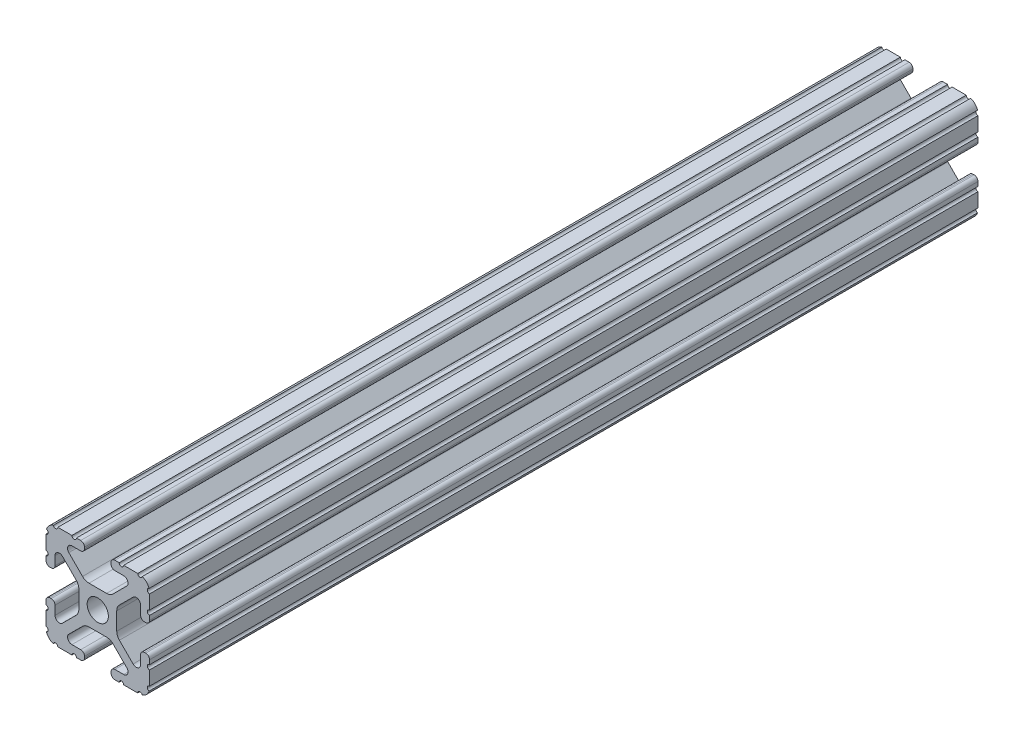
from build123d import *

# Parameters (mm, degrees)
BOSS_EXTRUDE1_DEPTH     = 152.4
CUT_EXTRUDE1_DEPTH      = 154.454683865
CUT_EXTRUDE1_DEPTH_BACK = 154.454683865
SKETCH5_R               = 0.55245
SKETCH6_W               = 50.8
SKETCH6_H               = 25.4
CUT_EXTRUDE2_DEPTH      = 156.02325632


with BuildPart() as part:
    # Sketch4 → Boss-Extrude1 (new, symmetric)
    with BuildSketch(Plane.XY):
        with BuildLine():
            Line((4.190365, -12.7), (10.11729625, -12.7))
            ThreePointArc((10.11729625, -12.7), (11.943543585, -11.943543585), (12.7, -10.11729625))
            Line((12.7, -10.11729625), (12.7, -4.190365))
            ThreePointArc((12.7, -4.190365), (12.42492494, -3.52627506), (11.760835, -3.2512))
            Line((11.760835, -3.2512), (11.429365, -3.2512))
            ThreePointArc((11.429365, -3.2512), (10.76527506, -3.52627506), (10.4902, -4.190365))
            Line((10.4902, -4.190365), (10.4902, -6.348478019))
            ThreePointArc((10.4902, -6.348478019), (9.830707141, -7.335478831), (8.666460301, -7.103895736))
            Line((8.666460301, -7.103895736), (5.299899128, -3.737334563))
            ThreePointArc((5.299899128, -3.737334563), (4.817571085, -3.015479634), (4.6482, -2.16399369))
            Line((4.6482, -2.16399369), (4.6482, 0))
            Line((4.6482, 0), (2.6035, 0))
            ThreePointArc((2.6035, 0), (1.840952505, -1.840952505), (0, -2.6035))
            Line((0, -2.6035), (0, -4.6482))
            Line((0, -4.6482), (2.16399369, -4.6482))
            ThreePointArc((2.16399369, -4.6482), (3.015479634, -4.817571085), (3.737334563, -5.299899128))
            Line((3.737334563, -5.299899128), (7.103895736, -8.666460301))
            ThreePointArc((7.103895736, -8.666460301), (7.335478831, -9.830707141), (6.348478019, -10.4902))
            Line((6.348478019, -10.4902), (4.190365, -10.4902))
            ThreePointArc((4.190365, -10.4902), (3.52627506, -10.76527506), (3.2512, -11.429365))
            Line((3.2512, -11.429365), (3.2512, -11.760835))
            ThreePointArc((3.2512, -11.760835), (3.52627506, -12.42492494), (4.190365, -12.7))
        make_face()
    extrude(amount=BOSS_EXTRUDE1_DEPTH, both=True)

    # Sketch5 → Cut-Extrude1 (cut, two sides: drawn at the far end of the back side and taken through both)
    with BuildSketch(Plane.XY.offset(-CUT_EXTRUDE1_DEPTH_BACK)):
        with Locations((10.356153152, -12.7)):
            Circle(SKETCH5_R)
        with Locations((5.796028019, -12.7)):
            Circle(SKETCH5_R)
        with Locations((12.7, -10.356153152)):
            Circle(SKETCH5_R)
        with Locations((12.7, -5.796028019)):
            Circle(SKETCH5_R)
    extrude(amount=CUT_EXTRUDE1_DEPTH + CUT_EXTRUDE1_DEPTH_BACK, mode=Mode.SUBTRACT)

    # Mirror1: part across plane


with BuildPart() as part_1:
    add(part.part)
    add(part.part.mirror(Plane(origin=(0, 0, 0), x_dir=(0, 0, 1), z_dir=(1, 0, 0))))

    # Mirror2: part across plane


with BuildPart() as part_2:
    add(part_1.part)
    add(part_1.part.mirror(Plane.ZX))

    # Sketch6 → Cut-Extrude2 (cut, through all)
    with BuildSketch(Plane(origin=(12.7, 0, 0), x_dir=(0, 0, -1), z_dir=(1, 0, 0))):
        with Locations((-127, 0)):
            Rectangle(SKETCH6_W, SKETCH6_H)
        with Locations((127, 0)):
            Rectangle(SKETCH6_W, SKETCH6_H)
    extrude(amount=-CUT_EXTRUDE2_DEPTH, mode=Mode.SUBTRACT)


solid = part_2.part
